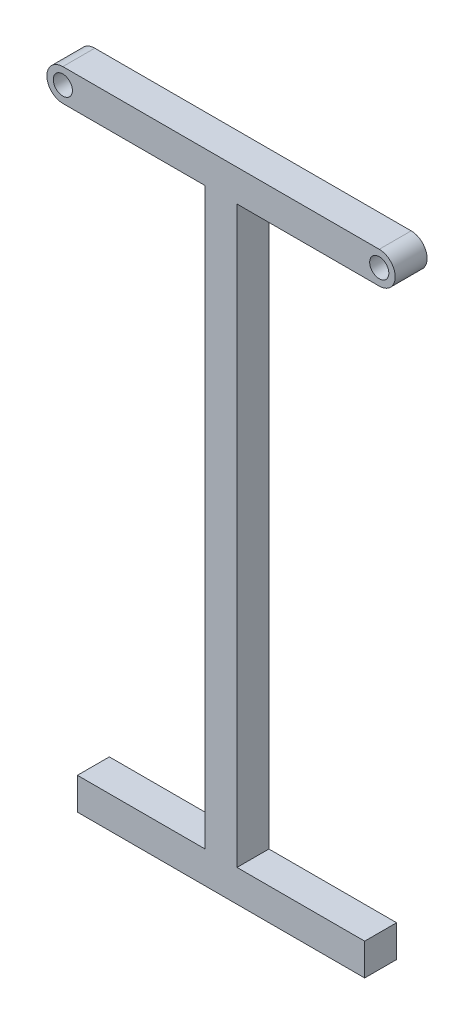
from build123d import *

# Parameters (mm, degrees)
SKETCH1_R           = 1.5
BOSS_EXTRUDE1_DEPTH = 2.5


with BuildPart() as part:
    # Sketch1 → Boss-Extrude1 (new, symmetric)
    with BuildSketch(Plane.XY):
        with BuildLine():
            Line((-24.78125, 50), (24.78125, 50))
            ThreePointArc((24.78125, 50), (27.28125, 47.5), (24.78125, 45))
            Line((24.78125, 45), (2.5, 45))
            Line((2.5, 45), (2.5, -45))
            Line((2.5, -45), (22.5, -45))
            Line((22.5, -45), (22.5, -50))
            Line((22.5, -50), (-22.5, -50))
            Line((-22.5, -50), (-22.5, -45))
            Line((-22.5, -45), (-2.5, -45))
            Line((-2.5, -45), (-2.5, 45))
            Line((-2.5, 45), (-24.78125, 45))
            ThreePointArc((-24.78125, 45), (-27.28125, 47.5), (-24.78125, 50))
        make_face()
        with Locations((-24.78125, 47.5)):
            Circle(SKETCH1_R, mode=Mode.SUBTRACT)
        with Locations((24.78125, 47.5)):
            Circle(SKETCH1_R, mode=Mode.SUBTRACT)
    extrude(amount=BOSS_EXTRUDE1_DEPTH, both=True)


solid = part.part
